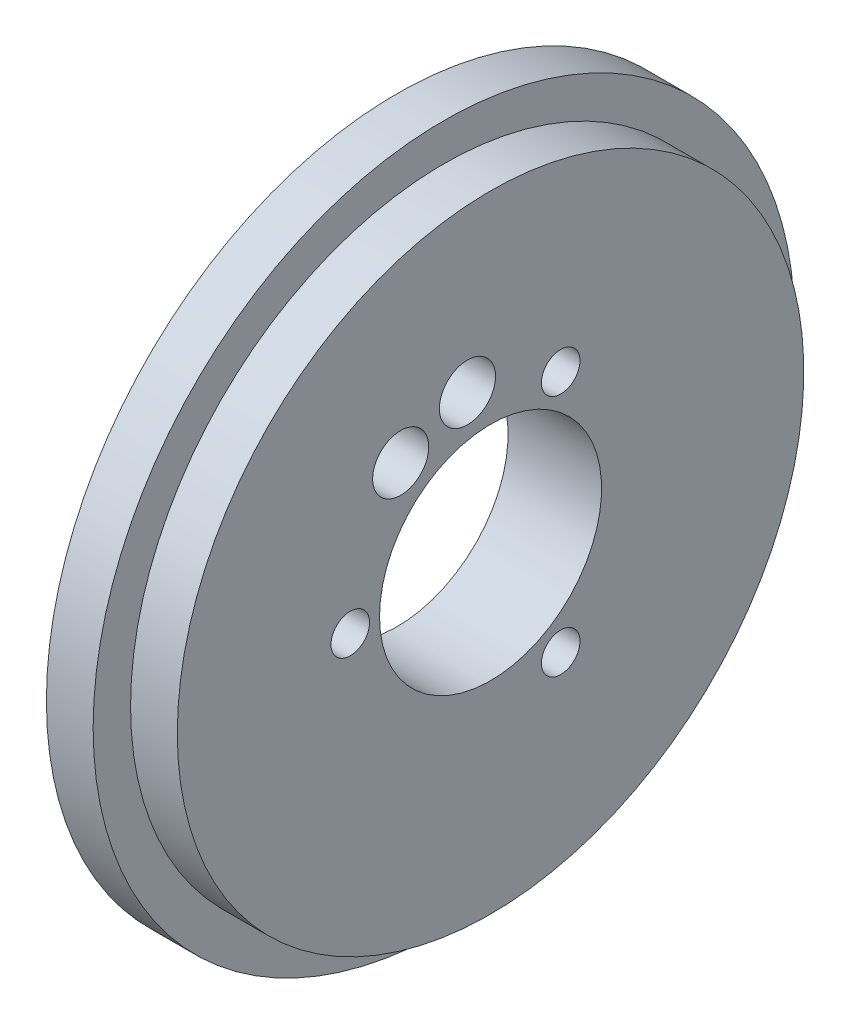
from build123d import *

# Parameters (mm, degrees)
AXIAL_HOLES_DEPTH      = 150.832206151
AXIAL_HOLES_DEPTH_BACK = 150.832206151
SKETCH2_R              = 2.4
SKETCH2_R_2            = 1.65


with BuildPart() as part:
    # Axial profile (mm) → Full revolution (revolve)
    with BuildSketch(Plane.XY, mode=Mode.PRIVATE) as full_revolution_sk:
        Polygon((135.7, 9.5), (143.7, 9.5), (143.7, 26.8), (139.7, 26.8), (139.7, 30), (135.7, 30), align=None)
    revolve(full_revolution_sk.sketch.rotate(Axis((-110, 0, 0), (1, 0, 0)), 90), axis=Axis((-110, 0, 0), (1, 0, 0)))

    # Sketch2 → Axial holes (cut, two sides: drawn at the far end of the back side and taken through both)
    with BuildSketch(Plane(origin=(0, 0, 0), x_dir=(0, 0, -1), z_dir=(1, 0, 0)).offset(-AXIAL_HOLES_DEPTH_BACK)):
        with Locations((-1.977382665, 12.848733704)):
            Circle(SKETCH2_R)
        with Locations((-7.687206041, 10.483647423)):
            Circle(SKETCH2_R)
        with Locations((-12, 0)):
            Circle(SKETCH2_R_2)
        with Locations((6, -10.392304845)):
            Circle(SKETCH2_R_2)
        with Locations((6, 10.392304845)):
            Circle(SKETCH2_R_2)
    extrude(amount=AXIAL_HOLES_DEPTH + AXIAL_HOLES_DEPTH_BACK, mode=Mode.SUBTRACT)


solid = part.part
